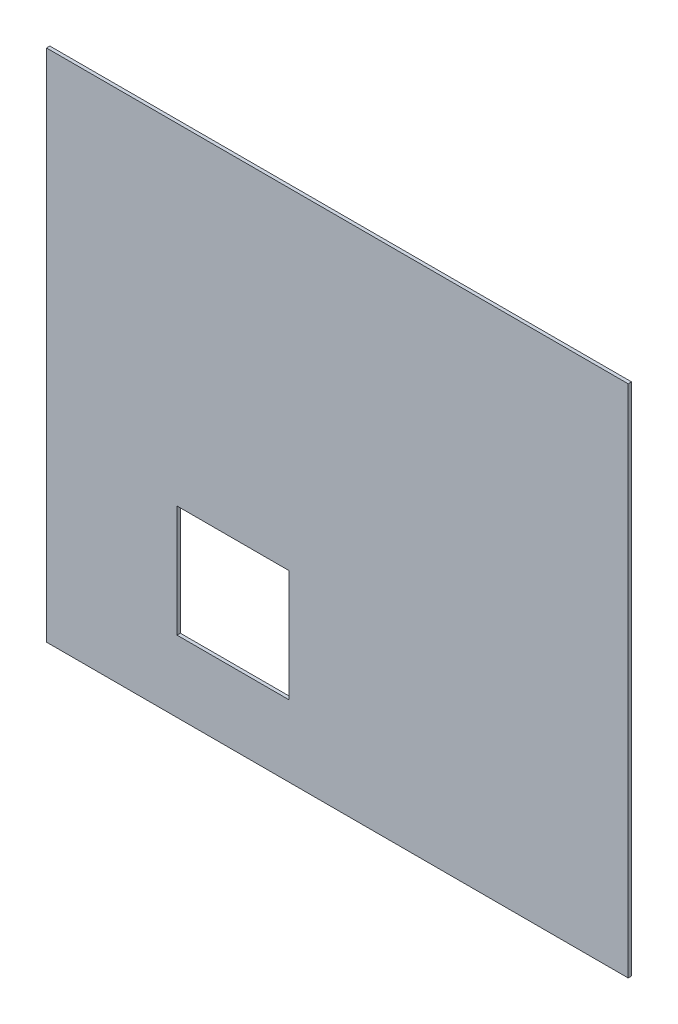
from build123d import *

# Parameters (mm, degrees)
SKETCH_1_W          = 520
SKETCH_1_H          = 460
EXTRUDE_1_DEPTH     = 3
SKETCH_2_W          = 100
SKETCH_2_H          = 100
CUT_EXTRUDE_1_DEPTH = 10


with BuildPart() as part:
    # 草图1 → 凸台-拉伸1 (new body)
    with BuildSketch(Plane.XY):
        Rectangle(SKETCH_1_W, SKETCH_1_H)
    extrude(amount=EXTRUDE_1_DEPTH)

    # 草图2 → 切除-拉伸1 (cut)
    with BuildSketch(Plane.XY.offset(3)):
        with Locations((-93.35, -116.22649935)):
            Rectangle(SKETCH_2_W, SKETCH_2_H)
    extrude(amount=-CUT_EXTRUDE_1_DEPTH, mode=Mode.SUBTRACT)


solid = part.part
